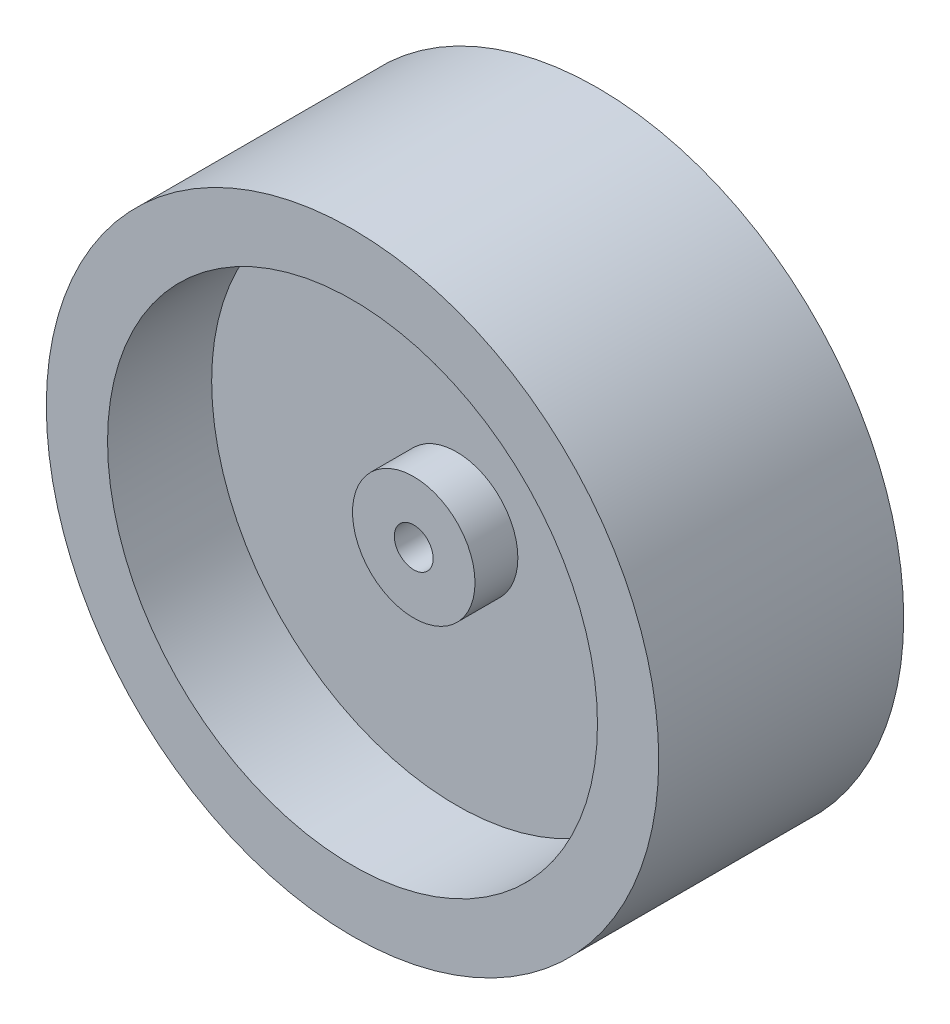
from build123d import *

# Parameters (mm, degrees)
SKETCH1_R           = 25
BOSS_EXTRUDE1_DEPTH = 1.5
SKETCH2_R           = 25
SKETCH2_R_2         = 20
BOSS_EXTRUDE2_DEPTH = 10
SKETCH3_R           = 5
BOSS_EXTRUDE3_DEPTH = 5
SKETCH4_R           = 1.585
CUT_EXTRUDE1_DEPTH  = 10


with BuildPart() as part:
    # Sketch1 → Boss-Extrude1 (new, symmetric)
    with BuildSketch(Plane.XY):
        Circle(SKETCH1_R)
    extrude(amount=BOSS_EXTRUDE1_DEPTH, both=True)

    # Sketch2 → Boss-Extrude2 (add, symmetric)
    with BuildSketch(Plane.XY):
        Circle(SKETCH2_R)
        Circle(SKETCH2_R_2, mode=Mode.SUBTRACT)
    extrude(amount=BOSS_EXTRUDE2_DEPTH, both=True)

    # Sketch3 → Boss-Extrude3 (add, symmetric)
    with BuildSketch(Plane.XY):
        Circle(SKETCH3_R)
    extrude(amount=BOSS_EXTRUDE3_DEPTH, both=True)

    # Sketch4 → Cut-Extrude1 (cut)
    with BuildSketch(Plane(origin=(0, 0, -5), x_dir=(-1, 0, 0), z_dir=(0, 0, -1))):
        Circle(SKETCH4_R)
    extrude(amount=-CUT_EXTRUDE1_DEPTH, mode=Mode.SUBTRACT)


solid = part.part
